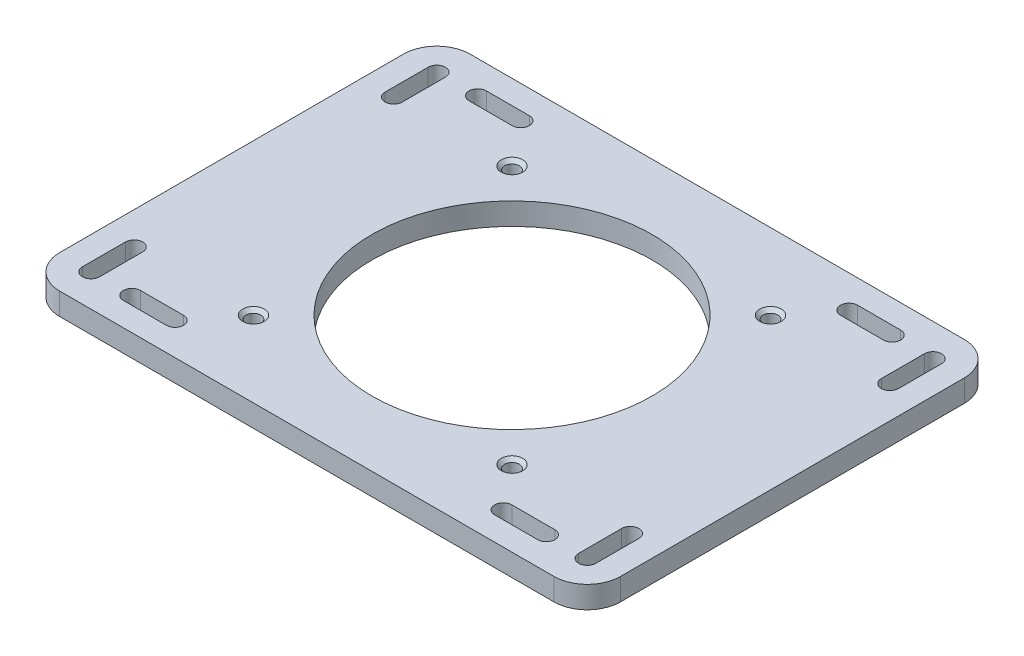
from build123d import *

# Parameters (mm, degrees)
SKETCH1_W                      = 260.35
SKETCH1_H                      = 190.5
BASE_DEPTH                     = 10.25
SKETCH2_R                      = 65
HOLES_DEPTH                    = 323.765293983
M8_ARM_MOUNT_HOLES_D           = 6.8
M8_ARM_MOUNT_HOLES_CSINK_D     = 10
M8_ARM_MOUNT_HOLES_CSINK_ANGLE = 90
FILLET1_R                      = 15.5


with BuildPart() as part:
    # Sketch1 → Base (new body)
    with BuildSketch(Plane(origin=(0, 0, 0), x_dir=(1, 0, 0), z_dir=(0, 1, 0))):
        with Locations((130.175, 95.25)):
            Rectangle(SKETCH1_W, SKETCH1_H)
    extrude(amount=BASE_DEPTH)

    # Sketch2 → Holes (cut, through all)
    with BuildSketch(Plane(origin=(0, 10.25, 0), x_dir=(1, 0, 0), z_dir=(0, 1, 0))):
        with Locations(Location((130.175, 95.25, 0), (0, 0, 270))):
            Circle(SKETCH2_R)
        with BuildLine():
            Line((206.35, 19), (226.35, 19))
            ThreePointArc((226.35, 19), (230.35, 15), (226.35, 11))
            Line((226.35, 11), (206.35, 11))
            ThreePointArc((206.35, 11), (202.35, 15), (206.35, 19))
        make_face()
        with BuildLine():
            Line((241.35, 15), (241.35, 35))
            ThreePointArc((241.35, 35), (245.35, 39), (249.35, 35))
            Line((249.35, 35), (249.35, 15))
            ThreePointArc((249.35, 15), (245.35, 11), (241.35, 15))
        make_face()
        with BuildLine():
            Line((11, 15), (11, 35))
            ThreePointArc((11, 35), (15, 39), (19, 35))
            Line((19, 35), (19, 15))
            ThreePointArc((19, 15), (15, 11), (11, 15))
        make_face()
        with BuildLine():
            Line((11, 155.5), (11, 175.5))
            ThreePointArc((11, 175.5), (15, 179.5), (19, 175.5))
            Line((19, 175.5), (19, 155.5))
            ThreePointArc((19, 155.5), (15, 151.5), (11, 155.5))
        make_face()
        with BuildLine():
            Line((241.35, 155.5), (241.35, 175.5))
            ThreePointArc((241.35, 175.5), (245.35, 179.5), (249.35, 175.5))
            Line((249.35, 175.5), (249.35, 155.5))
            ThreePointArc((249.35, 155.5), (245.35, 151.5), (241.35, 155.5))
        make_face()
        with BuildLine():
            Line((34, 19), (54, 19))
            ThreePointArc((54, 19), (58, 15), (54, 11))
            Line((54, 11), (34, 11))
            ThreePointArc((34, 11), (30, 15), (34, 19))
        make_face()
        with BuildLine():
            Line((206.35, 179.5), (226.35, 179.5))
            ThreePointArc((226.35, 179.5), (230.35, 175.5), (226.35, 171.5))
            Line((226.35, 171.5), (206.35, 171.5))
            ThreePointArc((206.35, 171.5), (202.35, 175.5), (206.35, 179.5))
        make_face()
        with BuildLine():
            Line((34, 179.5), (54, 179.5))
            ThreePointArc((54, 179.5), (58, 175.5), (54, 171.5))
            Line((54, 171.5), (34, 171.5))
            ThreePointArc((34, 171.5), (30, 175.5), (34, 179.5))
        make_face()
    extrude(amount=-HOLES_DEPTH, mode=Mode.SUBTRACT)

    # M8 Arm Mount Holes (through all)
    with Locations(Plane(origin=(0, 10.25, 0), x_dir=(1, 0, 0), z_dir=(0, 1, 0))):
        with Locations((70.175, 155.25), (190.175, 155.25), (190.175, 35.25), (70.175, 35.25)):
            CounterSinkHole(M8_ARM_MOUNT_HOLES_D / 2, M8_ARM_MOUNT_HOLES_CSINK_D / 2, counter_sink_angle=M8_ARM_MOUNT_HOLES_CSINK_ANGLE)

    # Fillet1
    fillet1_edges = [part.edges().sort_by_distance(p)[0] for p in [
        (0, 5.125, -190.5),
        (260.35, 5.125, -190.5),
        (260.35, 5.125, 0),
        (0, 5.125, 0),
    ]]
    fillet(fillet1_edges, radius=FILLET1_R)


solid = part.part
